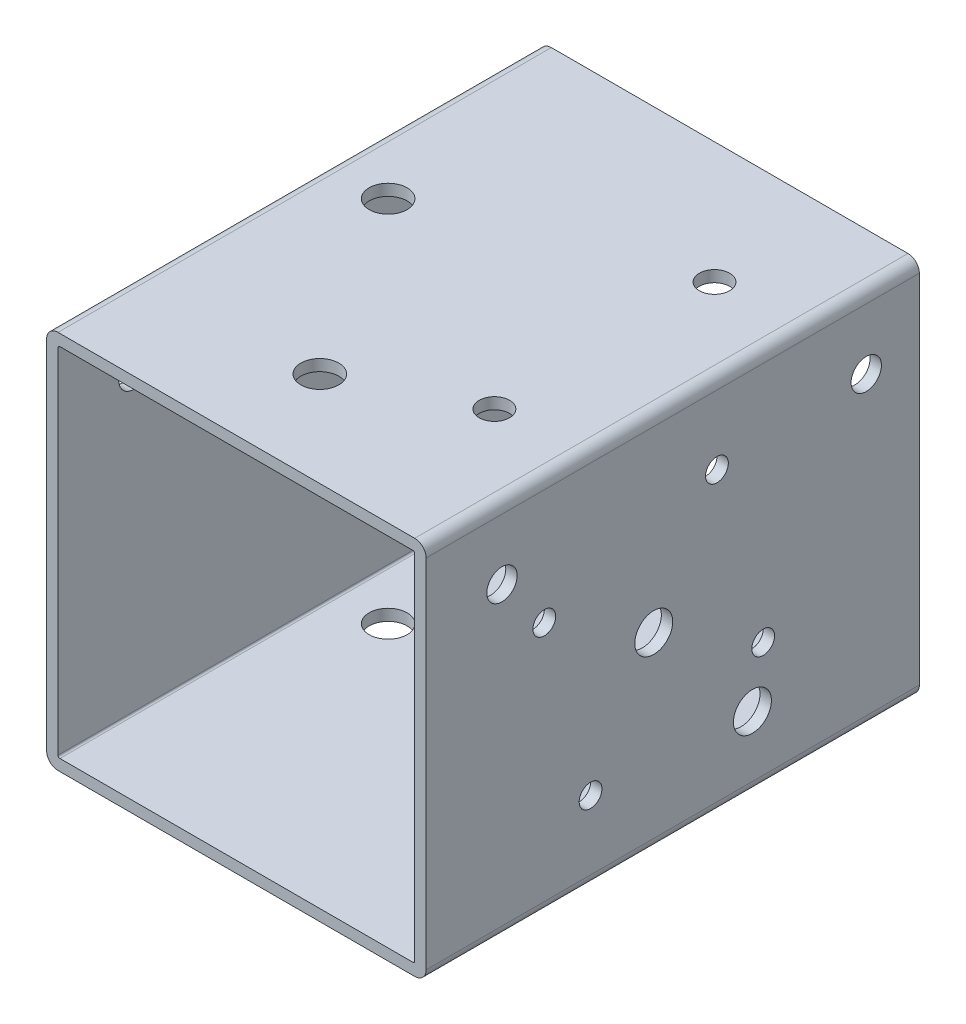
from build123d import *

# Parameters (mm, degrees)
SKETCH1_W                      = 100
SKETCH1_H                      = 100
SKETCH1_W_2                    = 94
SKETCH1_H_2                    = 94
EXTRUDE_THIN1_DEPTH            = 130
FILLET1_R                      = 0.5
FILLET2_R                      = 3
F_8_0_8_DIAMETER_HOLE2_D       = 8
F_8_0_8_DIAMETER_HOLE3_D       = 8
F_10_0_10_DIAMETER_HOLE1_D     = 10
F_10_0_10_DIAMETER_HOLE2_D     = 10
M8X1_25_TAPPED_HOLE1_D         = 6.8
M8X1_25_TAPPED_HOLE1_DEPTH     = 3
M8X1_25_TAPPED_HOLE2_D         = 6.8
M8X1_25_TAPPED_HOLE2_DEPTH     = 3
F_10_0_10_DIAMETER_HOLE3_D     = 10
F_10_0_10_DIAMETER_HOLE3_DEPTH = 3
F_6_0_6_DIAMETER_HOLE1_D       = 6
F_6_0_6_DIAMETER_HOLE1_DEPTH   = 3
F_10_0_10_DIAMETER_HOLE4_D     = 10
F_10_0_10_DIAMETER_HOLE4_DEPTH = 3


with BuildPart() as part:
    # Sketch1 → Extrude-Thin1 (new body)
    with BuildSketch(Plane.XY):
        Rectangle(SKETCH1_W, SKETCH1_H)
        Rectangle(SKETCH1_W_2, SKETCH1_H_2, mode=Mode.SUBTRACT)
    extrude(amount=EXTRUDE_THIN1_DEPTH)

    # Fillet1
    fillet1_edges = [part.edges().sort_by_distance(p)[0] for p in [
        (47, -47, 65),
        (47, 47, 65),
        (-47, 47, 65),
        (-47, -47, 65),
    ]]
    fillet(fillet1_edges, radius=FILLET1_R)

    # Fillet2
    fillet2_edges = [part.edges().sort_by_distance(p)[0] for p in [
        (50, -50, 65),
        (-50, -50, 65),
        (-50, 50, 65),
        (50, 50, 65),
    ]]
    fillet(fillet2_edges, radius=FILLET2_R)

    # Ø8.0 (8) Diameter Hole2 (through all)
    with Locations(Plane(origin=(0, 50, 0), x_dir=(1, 0, 0), z_dir=(0, 1, 0))):
        with Locations((28, -32), (28, -90)):
            Hole(F_8_0_8_DIAMETER_HOLE2_D / 2)

    # Ø8.0 (8) Diameter Hole3 (through all)
    with Locations(Plane(origin=(50, 0, 0), x_dir=(0, 0, -1), z_dir=(1, 0, 0))):
        with Locations((-14, 31), (-110, 31)):
            Hole(F_8_0_8_DIAMETER_HOLE3_D / 2)

    # Ø10.0 (10) Diameter Hole1 (through all)
    with Locations(Plane(origin=(0, 50, 0), x_dir=(1, 0, 0), z_dir=(0, 1, 0))):
        with Locations((-34, -56)):
            Hole(F_10_0_10_DIAMETER_HOLE1_D / 2)

    # Ø10.0 (10) Diameter Hole2 (through all)
    with Locations(Plane(origin=(50, 0, 0), x_dir=(0, 0, -1), z_dir=(1, 0, 0))):
        with Locations((-44, -31)):
            Hole(F_10_0_10_DIAMETER_HOLE2_D / 2)

    # M8x1.25 Tapped Hole1
    with Locations(Plane.ZY.offset(50)):
        with Locations((56, -15), (56, 35)):
            Hole(M8X1_25_TAPPED_HOLE1_D / 2, depth=M8X1_25_TAPPED_HOLE1_DEPTH)

    # M8x1.25 Tapped Hole2
    with Locations(Plane(origin=(0, -50, 0), x_dir=(-1, 0, 0), z_dir=(0, -1, 0))):
        with Locations((20, -44), (-35, -44)):
            Hole(M8X1_25_TAPPED_HOLE2_D / 2, depth=M8X1_25_TAPPED_HOLE2_DEPTH)

    # Ø10.0 (10) Diameter Hole3
    with Locations(Plane(origin=(50, 0, 0), x_dir=(0, 0, -1), z_dir=(1, 0, 0))):
        with Locations((-70, 0)):
            Hole(F_10_0_10_DIAMETER_HOLE3_D / 2, depth=F_10_0_10_DIAMETER_HOLE3_DEPTH)

    # Ø6.0 (6) Diameter Hole1
    with Locations(Plane(origin=(50, 0, 0), x_dir=(0, 0, -1), z_dir=(1, 0, 0))):
        with Locations((-41.157258279, -16.652364697), (-53.347635303, 28.842741721), (-98.842741721, 16.652364697), (-86.652364697, -28.842741721)):
            Hole(F_6_0_6_DIAMETER_HOLE1_D / 2, depth=F_6_0_6_DIAMETER_HOLE1_DEPTH)

    # Ø10.0 (10) Diameter Hole4
    with Locations(Plane(origin=(0, 50, 0), x_dir=(1, 0, 0), z_dir=(0, 1, 0))):
        with Locations((-3, -105)):
            Hole(F_10_0_10_DIAMETER_HOLE4_D / 2, depth=F_10_0_10_DIAMETER_HOLE4_DEPTH)


solid = part.part
